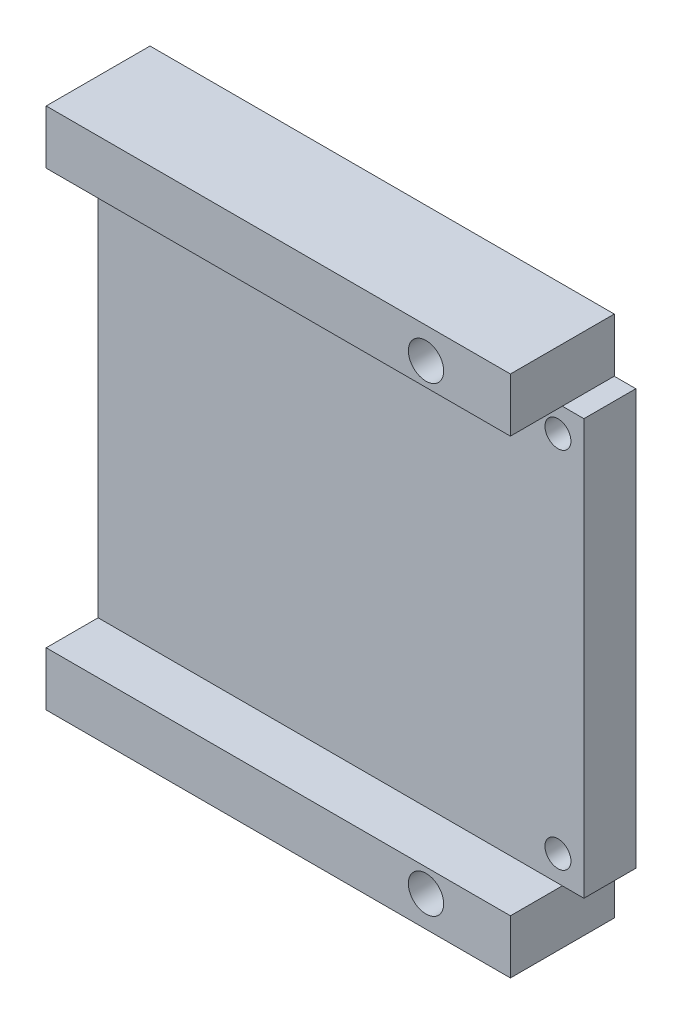
from build123d import *

# Parameters (mm, degrees)
SKETCH1_R           = 1.25
SKETCH1_R_2         = 1.250329794
SKETCH1_R_3         = 1.7
BOSS_EXTRUDE1_DEPTH = 5
SKETCH2_R           = 1.7
SKETCH2_W           = 44.709414805
SKETCH2_H           = 5.189
BOSS_EXTRUDE2_DEPTH = 5


with BuildPart() as part:
    # Sketch1 → Boss-Extrude1 (new body)
    with BuildSketch(Plane.XY):
        Polygon((85.253810187, 98.97317398), (129.963224992, 98.97317398), (129.963224992, 93.786173942), (132.040225419, 93.78317398), (132.040225419, 53.78317398), (129.963224992, 53.78317398), (129.963224992, 48.59417398), (85.253810187, 48.59417398), align=None)
        with Locations((129.540225419, 91.28317398)):
            Circle(SKETCH1_R, mode=Mode.SUBTRACT)
        with Locations((129.540225419, 56.254458242)):
            Circle(SKETCH1_R_2, mode=Mode.SUBTRACT)
        with Locations((121.835225419, 51.56417398)):
            Circle(SKETCH1_R_3, mode=Mode.SUBTRACT)
        with Locations((121.835225419, 96.00317398)):
            Circle(SKETCH1_R_3, mode=Mode.SUBTRACT)
    extrude(amount=BOSS_EXTRUDE1_DEPTH)

    # Sketch2 → Boss-Extrude2 (add)
    # profile 1 of 2: a face of its own
    with BuildSketch(Plane.XY.offset(5)):
        Polygon((129.963224992, 93.786173942), (85.253810187, 93.78317398), (85.253810187, 98.97317398), (129.963224992, 98.97317398), align=None)
        with Locations((121.835225419, 96.00317398)):
            Circle(SKETCH2_R, mode=Mode.SUBTRACT)
    # profile 2 of 2: a face of its own
    with BuildSketch(Plane.XY.offset(5)):
        with Locations((107.60851759, 51.18867398)):
            Rectangle(SKETCH2_W, SKETCH2_H)
        with Locations((121.835225419, 51.56417398)):
            Circle(SKETCH2_R, mode=Mode.SUBTRACT)
    extrude(amount=BOSS_EXTRUDE2_DEPTH)


solid = part.part
